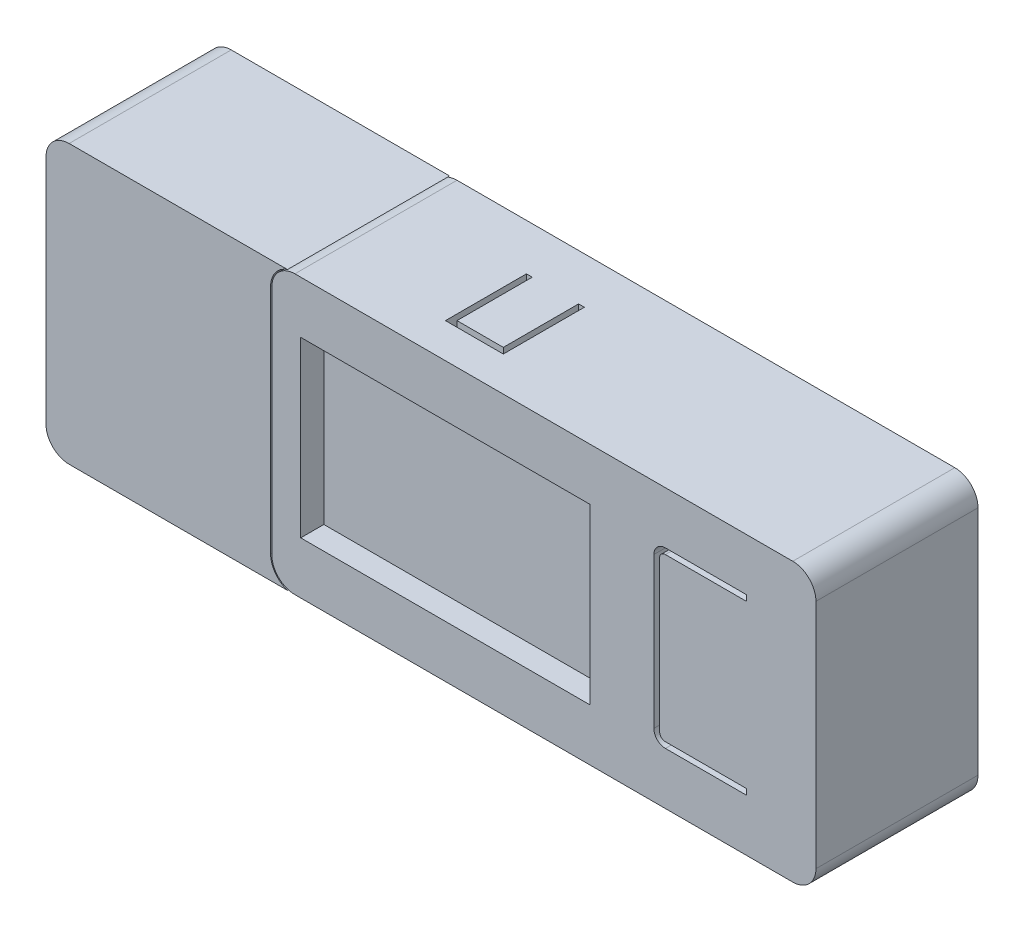
from build123d import *

# Parameters (mm, degrees)
CROQUIS1_W              = 47
CROQUIS1_H              = 24
SALIENTE_EXTRUIR1_DEPTH = 14
REDONDEO1_R             = 2
CROQUIS2_W              = 25
CROQUIS2_H              = 15
CORTAR_EXTRUIR1_DEPTH   = 2
CORTAR_EXTRUIR2_DEPTH   = 5
CORTAR_EXTRUIR3_DEPTH   = 5
SALIENTE_EXTRUIR3_DEPTH = 14
CROQUIS6_R              = 4.5
CROQUIS6_R_2            = 1
CORTAR_EXTRUIR4_DEPTH   = 2


with BuildPart() as part:
    # Croquis1 → Saliente-Extruir1 (new body)
    with BuildSketch(Plane.XY):
        Rectangle(CROQUIS1_W, CROQUIS1_H)
    extrude(amount=SALIENTE_EXTRUIR1_DEPTH)

    # Redondeo1
    redondeo1_edges = [part.edges().sort_by_distance(p)[0] for p in [
        (-23.5, 12, 7),
        (23.5, 12, 7),
        (23.5, -12, 7),
        (-23.5, -12, 7),
    ]]
    fillet(redondeo1_edges, radius=REDONDEO1_R)

    # Croquis2 → Cortar-Extruir1 (cut)
    with BuildSketch(Plane.XY.offset(14)):
        with Locations((-8.5, 0)):
            Rectangle(CROQUIS2_W, CROQUIS2_H)
        with BuildLine():
            Line((17.5, 7.5), (10.5, 7.5))
            ThreePointArc((10.5, 7.5), (9.792893219, 7.207106781), (9.5, 6.5))
            Line((9.5, 6.5), (9.5, -6.5))
            ThreePointArc((9.5, -6.5), (9.792893219, -7.207106781), (10.5, -7.5))
            Line((10.5, -7.5), (17.5, -7.5))
            Line((17.5, -7.5), (17.5, -7))
            Line((17.5, -7), (10.5, -7))
            ThreePointArc((10.5, -7), (10.146446609, -6.853553391), (10, -6.5))
            Line((10, -6.5), (10, 6.5))
            ThreePointArc((10, 6.5), (10.146446609, 6.853553391), (10.5, 7))
            Line((10.5, 7), (17.5, 7))
            Line((17.5, 7), (17.5, 7.5))
        make_face()
    extrude(amount=-CORTAR_EXTRUIR1_DEPTH, mode=Mode.SUBTRACT)

    # Croquis3 → Cortar-Extruir2 (cut)
    with BuildSketch(Plane(origin=(0, 12, 0), x_dir=(1, 0, 0), z_dir=(0, 1, 0))):
        Polygon((-6.5, -4), (-6.5, -11), (-11.5, -11), (-11.5, -4), (-11, -4), (-11, -10.5), (-7, -10.5), (-7, -4), align=None)
    extrude(amount=-CORTAR_EXTRUIR2_DEPTH, mode=Mode.SUBTRACT)

    # Croquis4 → Cortar-Extruir3 (cut)
    with BuildSketch(Plane.XZ.offset(12)):
        Polygon((16.5, 11), (16.5, 4), (11.5, 4), (11.5, 11), (12, 11), (12, 4.5), (16, 4.5), (16, 11), align=None)
    extrude(amount=-CORTAR_EXTRUIR3_DEPTH, mode=Mode.SUBTRACT)


with BuildPart() as body_2:
    # Croquis5 → Saliente-Extruir3 (new body)
    with BuildSketch(Plane.XY):
        with BuildLine():
            Line((-22.140312424, 12), (-41, 12))
            ThreePointArc((-41, 12), (-42.414213562, 11.414213562), (-43, 10))
            Line((-43, 10), (-43, -10))
            ThreePointArc((-43, -10), (-42.414213562, -11.414213562), (-41, -12))
            Line((-41, -12), (-22.140312424, -12))
            ThreePointArc((-22.140312424, -12), (-23.19626886, -11.23801129), (-23.6, -10))
            Line((-23.6, -10), (-23.6, 10))
            ThreePointArc((-23.6, 10), (-23.19626886, 11.23801129), (-22.140312424, 12))
        make_face()
    extrude(amount=SALIENTE_EXTRUIR3_DEPTH)


with BuildPart() as cortar_extruir4_tool:
    # Croquis6 → Cortar-Extruir4 (new body)
    with BuildSketch(Plane(origin=(0, 0, 0), x_dir=(-1, 0, 0), z_dir=(0, 0, -1))):
        with Locations((36, 0)):
            Circle(CROQUIS6_R)
        with Locations((-14, 8)):
            Circle(CROQUIS6_R_2)
        with Locations((-14, -8)):
            Circle(CROQUIS6_R_2)
    extrude(amount=-CORTAR_EXTRUIR4_DEPTH)


with BuildPart() as part_1:
    add(part.part)

    # Cortar-Extruir4: cut by cortar_extruir4_tool
    add(cortar_extruir4_tool.part, mode=Mode.SUBTRACT)


with BuildPart() as body_2_1:
    add(body_2.part)

    # Cortar-Extruir4: cut by cortar_extruir4_tool
    add(cortar_extruir4_tool.part, mode=Mode.SUBTRACT)


solid = Compound([part_1.part, body_2_1.part])
